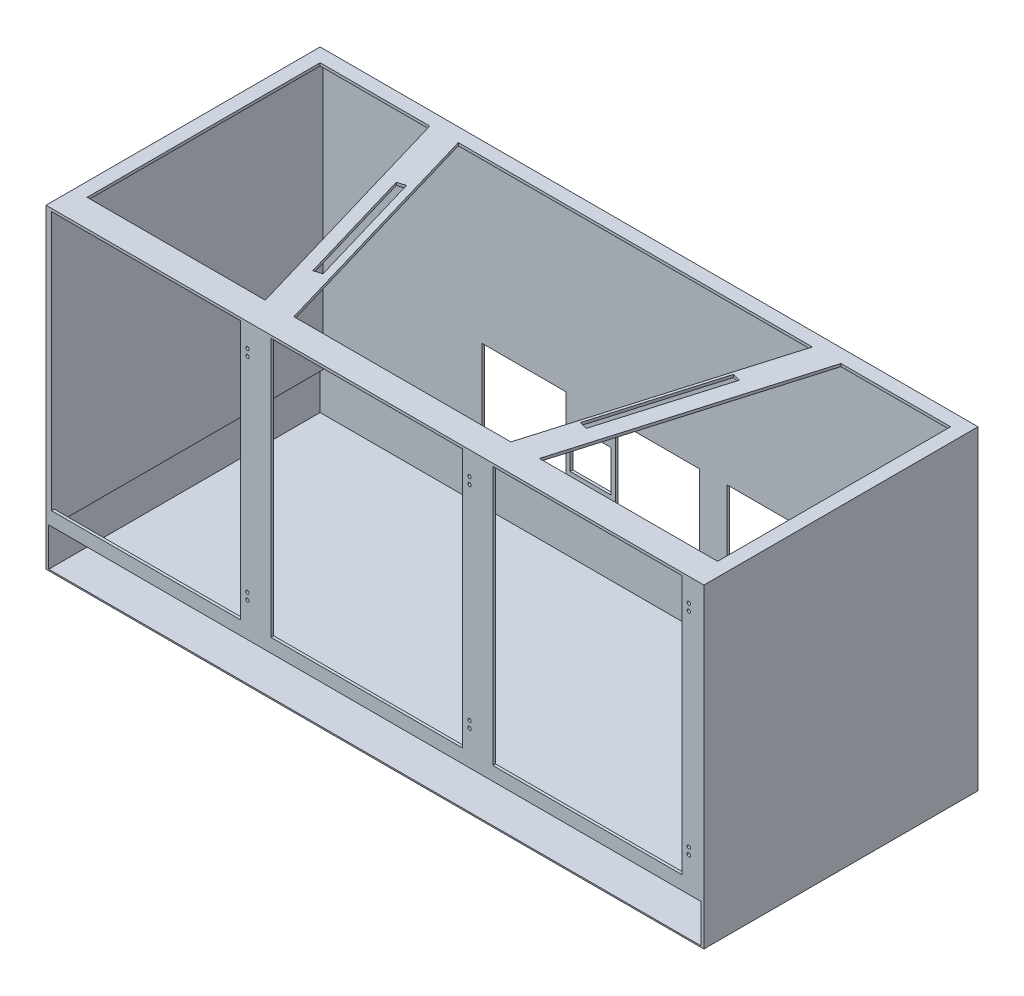
from build123d import *

# Parameters (mm, degrees)
SKETCH1_W           = 609.6
SKETCH1_H           = 254
BOSS_EXTRUDE1_DEPTH = 292.1
SKETCH2_W           = 604.52
SKETCH2_H           = 35.56
CUT_EXTRUDE1_DEPTH  = 251.46
SKETCH3_W           = 175.26
SKETCH3_H           = 240.03
SKETCH3_W_2         = 177.8
CUT_EXTRUDE2_DEPTH  = 251.46
SKETCH4_W           = 248.92
SKETCH4_H           = 240.03
CUT_EXTRUDE3_DEPTH  = 599.44
CUT_EXTRUDE4_DEPTH  = 242.57
SKETCH6_W           = 77.8256
SKETCH6_H           = 82.296
SKETCH6_W_2         = 38.1
SKETCH6_H_2         = 38.1
CUT_EXTRUDE5_DEPTH  = 492.383334679
SKETCH12_W          = 599.44
SKETCH12_H          = 248.92
CUT_EXTRUDE8_DEPTH  = 12.7
SKETCH13_R          = 3.175
CUT_EXTRUDE9_DEPTH  = 1.27
CUT_EXTRUDE10_START = -1.27
SKETCH14_R          = 3.175
CUT_EXTRUDE10_DEPTH = 1.27
SKETCH15_R          = 1.5875
CUT_EXTRUDE11_DEPTH = 6.35
CUT_EXTRUDE13_DEPTH = 2.54


with BuildPart() as part:
    # Sketch1 → Boss-Extrude1 (new body)
    with BuildSketch(Plane(origin=(0, 0, 0), x_dir=(1, 0, 0), z_dir=(0, 1, 0))):
        Rectangle(SKETCH1_W, SKETCH1_H)
    extrude(amount=-BOSS_EXTRUDE1_DEPTH)

    # Sketch2 → Cut-Extrude1 (cut)
    with BuildSketch(Plane.XY.offset(127)):
        with Locations((0, -273.05)):
            Rectangle(SKETCH2_W, SKETCH2_H)
    extrude(amount=-CUT_EXTRUDE1_DEPTH, mode=Mode.SUBTRACT)

    # Sketch3 → Cut-Extrude2 (cut)
    with BuildSketch(Plane.XY.offset(127)):
        with Locations((-212.09, -122.555)):
            Rectangle(SKETCH3_W, SKETCH3_H)
        with Locations((-7.62, -122.555)):
            Rectangle(SKETCH3_W_2, SKETCH3_H)
        with Locations((196.85, -122.555)):
            Rectangle(SKETCH3_W, SKETCH3_H)
    extrude(amount=-CUT_EXTRUDE2_DEPTH, mode=Mode.SUBTRACT)

    # Sketch4 → Cut-Extrude3 (cut)
    with BuildSketch(Plane(origin=(-299.72, 0, 0), x_dir=(0, 0, -1), z_dir=(1, 0, 0))):
        with Locations((0, -122.555)):
            Rectangle(SKETCH4_W, SKETCH4_H)
    extrude(amount=CUT_EXTRUDE3_DEPTH, mode=Mode.SUBTRACT)

    # Sketch5 → Cut-Extrude4 (cut)
    with BuildSketch(Plane(origin=(0, 0, 0), x_dir=(1, 0, 0), z_dir=(0, 1, 0))):
        Polygon((-292.1, 114.3), (-190.5, 114.3), (-127, -101.6), (-292.1, -101.6), align=None)
        Polygon((-164.02416784, 114.3), (-100.52416784, -101.6), (100.52416784, -101.6), (164.02416784, 114.3), align=None)
        Polygon((292.1, 114.3), (292.1, -101.6), (127, -101.6), (190.5, 114.3), align=None)
    extrude(amount=-CUT_EXTRUDE4_DEPTH, mode=Mode.SUBTRACT)

    # Sketch6 → Cut-Extrude5 (cut, through all)
    with BuildSketch(Plane.XY.offset(-124.46)):
        with Locations((-113.4872, -201.422)):
            Rectangle(SKETCH6_W, SKETCH6_H)
        with Locations((10.2616, -201.422)):
            Rectangle(SKETCH6_W, SKETCH6_H)
        with Locations((113.4872, -201.422)):
            Rectangle(SKETCH6_W, SKETCH6_H)
        with Locations((-51.6128, -203.2)):
            Rectangle(SKETCH6_W_2, SKETCH6_H_2)
    extrude(amount=-CUT_EXTRUDE5_DEPTH, mode=Mode.SUBTRACT)

    # Sketch12 → Cut-Extrude8 (cut)
    with BuildSketch(Plane.XZ.offset(255.27)):
        Rectangle(SKETCH12_W, SKETCH12_H)
    extrude(amount=-CUT_EXTRUDE8_DEPTH, mode=Mode.SUBTRACT)

    # Sketch13 → Cut-Extrude9 (cut)
    with BuildSketch(Plane(origin=(0, 0, 124.46), x_dir=(-1, 0, 0), z_dir=(0, 0, -1))):
        with Locations(Location((-295.275, -248.92, 0), (0, 0, 90))):
            Circle(SKETCH13_R)
        with Locations(Location((-276.225, -248.92, 0), (0, 0, 90))):
            Circle(SKETCH13_R)
        with Locations(Location((-257.175, -248.92, 0), (0, 0, 90))):
            Circle(SKETCH13_R)
        with Locations(Location((-238.125, -248.92, 0), (0, 0, 90))):
            Circle(SKETCH13_R)
        with Locations(Location((-219.075, -248.92, 0), (0, 0, 90))):
            Circle(SKETCH13_R)
        with Locations(Location((-200.025, -248.92, 0), (0, 0, 90))):
            Circle(SKETCH13_R)
        with Locations(Location((-180.975, -248.92, 0), (0, 0, 90))):
            Circle(SKETCH13_R)
        with Locations(Location((-161.925, -248.92, 0), (0, 0, 90))):
            Circle(SKETCH13_R)
        with Locations(Location((-142.875, -248.92, 0), (0, 0, 90))):
            Circle(SKETCH13_R)
        with Locations(Location((-123.825, -248.92, 0), (0, 0, 90))):
            Circle(SKETCH13_R)
        with Locations(Location((-104.775, -248.92, 0), (0, 0, 90))):
            Circle(SKETCH13_R)
        with Locations(Location((-85.725, -248.92, 0), (0, 0, 90))):
            Circle(SKETCH13_R)
        with Locations(Location((-66.675, -248.92, 0), (0, 0, 90))):
            Circle(SKETCH13_R)
        with Locations(Location((-47.625, -248.92, 0), (0, 0, 90))):
            Circle(SKETCH13_R)
        with Locations(Location((-28.575, -248.92, 0), (0, 0, 90))):
            Circle(SKETCH13_R)
        with Locations(Location((-9.525, -248.92, 0), (0, 0, 90))):
            Circle(SKETCH13_R)
        with Locations(Location((9.525, -248.92, 0), (0, 0, 270))):
            Circle(SKETCH13_R)
        with Locations(Location((28.575, -248.92, 0), (0, 0, 270))):
            Circle(SKETCH13_R)
        with Locations(Location((47.625, -248.92, 0), (0, 0, 270))):
            Circle(SKETCH13_R)
        with Locations(Location((66.675, -248.92, 0), (0, 0, 270))):
            Circle(SKETCH13_R)
        with Locations(Location((85.725, -248.92, 0), (0, 0, 270))):
            Circle(SKETCH13_R)
        with Locations(Location((104.775, -248.92, 0), (0, 0, 270))):
            Circle(SKETCH13_R)
        with Locations(Location((123.825, -248.92, 0), (0, 0, 270))):
            Circle(SKETCH13_R)
        with Locations(Location((142.875, -248.92, 0), (0, 0, 270))):
            Circle(SKETCH13_R)
        with Locations(Location((161.925, -248.92, 0), (0, 0, 270))):
            Circle(SKETCH13_R)
        with Locations(Location((180.975, -248.92, 0), (0, 0, 270))):
            Circle(SKETCH13_R)
        with Locations(Location((200.025, -248.92, 0), (0, 0, 270))):
            Circle(SKETCH13_R)
        with Locations(Location((219.075, -248.92, 0), (0, 0, 270))):
            Circle(SKETCH13_R)
        with Locations(Location((238.125, -248.92, 0), (0, 0, 270))):
            Circle(SKETCH13_R)
        with Locations(Location((257.175, -248.92, 0), (0, 0, 270))):
            Circle(SKETCH13_R)
        with Locations(Location((276.225, -248.92, 0), (0, 0, 270))):
            Circle(SKETCH13_R)
        with Locations(Location((295.275, -248.92, 0), (0, 0, 270))):
            Circle(SKETCH13_R)
    extrude(amount=-CUT_EXTRUDE9_DEPTH, mode=Mode.SUBTRACT)

    # Sketch14 → Cut-Extrude10 (cut)
    with BuildSketch(Plane.XY.offset(-124.46).offset(CUT_EXTRUDE10_START)):
        with Locations(Location((-295.275, -248.92, 0), (0, 0, 270))):
            Circle(SKETCH14_R)
        with Locations(Location((-276.225, -248.92, 0), (0, 0, 270))):
            Circle(SKETCH14_R)
        with Locations(Location((-257.175, -248.92, 0), (0, 0, 270))):
            Circle(SKETCH14_R)
        with Locations(Location((-238.125, -248.92, 0), (0, 0, 270))):
            Circle(SKETCH14_R)
        with Locations(Location((-219.075, -248.92, 0), (0, 0, 270))):
            Circle(SKETCH14_R)
        with Locations(Location((-200.025, -248.92, 0), (0, 0, 270))):
            Circle(SKETCH14_R)
        with Locations(Location((-180.975, -248.92, 0), (0, 0, 270))):
            Circle(SKETCH14_R)
        with Locations(Location((-161.925, -248.92, 0), (0, 0, 270))):
            Circle(SKETCH14_R)
        with Locations(Location((-142.875, -248.92, 0), (0, 0, 270))):
            Circle(SKETCH14_R)
        with Locations(Location((-123.825, -248.92, 0), (0, 0, 270))):
            Circle(SKETCH14_R)
        with Locations(Location((-104.775, -248.92, 0), (0, 0, 270))):
            Circle(SKETCH14_R)
        with Locations(Location((-85.725, -248.92, 0), (0, 0, 270))):
            Circle(SKETCH14_R)
        with Locations(Location((-66.675, -248.92, 0), (0, 0, 270))):
            Circle(SKETCH14_R)
        with Locations(Location((-47.625, -248.92, 0), (0, 0, 270))):
            Circle(SKETCH14_R)
        with Locations(Location((-28.575, -248.92, 0), (0, 0, 270))):
            Circle(SKETCH14_R)
        with Locations(Location((-9.525, -248.92, 0), (0, 0, 270))):
            Circle(SKETCH14_R)
        with Locations(Location((9.525, -248.92, 0), (0, 0, 90))):
            Circle(SKETCH14_R)
        with Locations(Location((28.575, -248.92, 0), (0, 0, 90))):
            Circle(SKETCH14_R)
        with Locations(Location((47.625, -248.92, 0), (0, 0, 90))):
            Circle(SKETCH14_R)
        with Locations(Location((66.675, -248.92, 0), (0, 0, 90))):
            Circle(SKETCH14_R)
        with Locations(Location((85.725, -248.92, 0), (0, 0, 90))):
            Circle(SKETCH14_R)
        with Locations(Location((104.775, -248.92, 0), (0, 0, 90))):
            Circle(SKETCH14_R)
        with Locations(Location((123.825, -248.92, 0), (0, 0, 90))):
            Circle(SKETCH14_R)
        with Locations(Location((142.875, -248.92, 0), (0, 0, 90))):
            Circle(SKETCH14_R)
        with Locations(Location((161.925, -248.92, 0), (0, 0, 90))):
            Circle(SKETCH14_R)
        with Locations(Location((180.975, -248.92, 0), (0, 0, 90))):
            Circle(SKETCH14_R)
        with Locations(Location((200.025, -248.92, 0), (0, 0, 90))):
            Circle(SKETCH14_R)
        with Locations(Location((219.075, -248.92, 0), (0, 0, 90))):
            Circle(SKETCH14_R)
        with Locations(Location((238.125, -248.92, 0), (0, 0, 90))):
            Circle(SKETCH14_R)
        with Locations(Location((257.175, -248.92, 0), (0, 0, 90))):
            Circle(SKETCH14_R)
        with Locations(Location((276.225, -248.92, 0), (0, 0, 90))):
            Circle(SKETCH14_R)
        with Locations(Location((295.275, -248.92, 0), (0, 0, 90))):
            Circle(SKETCH14_R)
    extrude(amount=CUT_EXTRUDE10_DEPTH, mode=Mode.SUBTRACT)

    # Sketch15 → Cut-Extrude11 (cut)
    with BuildSketch(Plane.XY.offset(127)):
        with Locations((-118.11, -21.59)):
            Circle(SKETCH15_R)
        with Locations((-118.11, -27.94)):
            Circle(SKETCH15_R)
        with Locations((87.63, -21.59)):
            Circle(SKETCH15_R)
        with Locations((87.63, -27.94)):
            Circle(SKETCH15_R)
        with Locations((290.83, -21.59)):
            Circle(SKETCH15_R)
        with Locations((290.83, -27.94)):
            Circle(SKETCH15_R)
        with Locations(Location((290.83, -217.17, 0), (0, 0, 90))):
            Circle(SKETCH15_R)
        with Locations(Location((290.83, -223.52, 0), (0, 0, 90))):
            Circle(SKETCH15_R)
        with Locations(Location((87.63, -217.17, 0), (0, 0, 90))):
            Circle(SKETCH15_R)
        with Locations(Location((87.63, -223.52, 0), (0, 0, 90))):
            Circle(SKETCH15_R)
        with Locations(Location((-118.11, -217.17, 0), (0, 0, 90))):
            Circle(SKETCH15_R)
        with Locations(Location((-118.11, -223.52, 0), (0, 0, 90))):
            Circle(SKETCH15_R)
    extrude(amount=-CUT_EXTRUDE11_DEPTH, mode=Mode.SUBTRACT)

    # Sketch16 → Cut-Extrude13 (cut)
    with BuildSketch(Plane(origin=(0, 0, 0), x_dir=(1, 0, 0), z_dir=(0, 1, 0))):
        Polygon((149.496101676, 55.902792109), (117.244490844, -53.75268472), (124.554855966, -55.902792109), (156.806466798, 53.75268472), align=None)
        Polygon((-160.939716834, 53.75268472), (-128.688106002, -55.902792109), (-121.37774088, -53.75268472), (-153.629351712, 55.902792109), align=None)
    extrude(amount=-CUT_EXTRUDE13_DEPTH, mode=Mode.SUBTRACT)


solid = part.part
